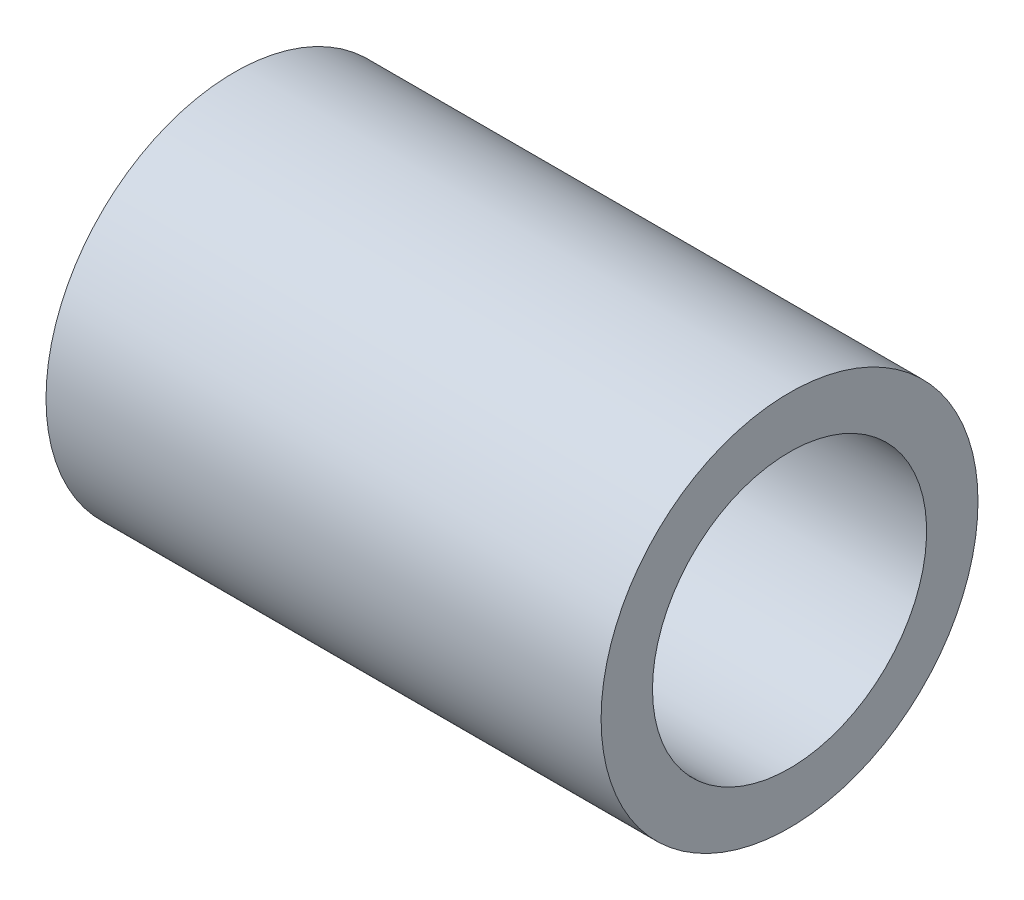
from build123d import *

# Parameters (mm, degrees)
SKETCH1_W = 16.2
SKETCH1_H = 5.5
SKETCH2_W = 16.2
SKETCH2_H = 4


with BuildPart() as part:
    # Sketch1 → Revolve1 (revolve)
    with BuildSketch(Plane.XY, mode=Mode.PRIVATE) as revolve1_sk:
        with Locations((8.1, 2.75)):
            Rectangle(SKETCH1_W, SKETCH1_H)
    revolve(revolve1_sk.sketch.rotate(Axis((-3.30725722, 0, 0), (1, 0, 0)), 90), axis=Axis((-3.30725722, 0, 0), (1, 0, 0)))

    # Sketch2 → Cut-Revolve1 (revolve, cut)
    with BuildSketch(Plane.XY, mode=Mode.PRIVATE) as cut_revolve1_sk:
        with Locations((8.1, 2)):
            Rectangle(SKETCH2_W, SKETCH2_H)
    revolve(cut_revolve1_sk.sketch.rotate(Axis((-3.053927559, 0, 0), (1, 0, 0)), 90), axis=Axis((-3.053927559, 0, 0), (1, 0, 0)), mode=Mode.SUBTRACT)


solid = part.part
